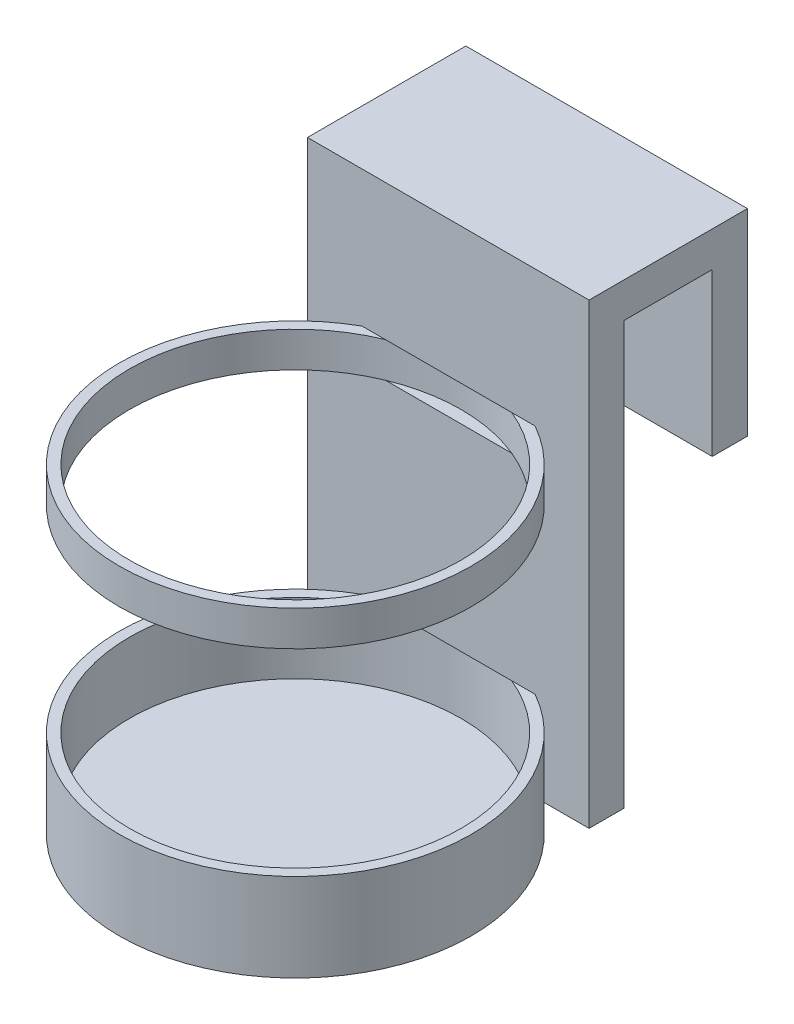
from build123d import *

# Parameters (mm, degrees)
BOSS_EXTRUDE1_DEPTH = 80
SKETCH2_R           = 50
BOSS_EXTRUDE2_DEPTH = 10
SKETCH3_R           = 47.09331112
CUT_EXTRUDE1_DEPTH  = 10
SKETCH4_R           = 50
BOSS_EXTRUDE3_DEPTH = 25
SKETCH5_R           = 47.09331112
CUT_EXTRUDE2_DEPTH  = 20


with BuildPart() as part:
    # Sketch1 → Boss-Extrude1 (new body)
    with BuildSketch(Plane(origin=(0, 0, 0), x_dir=(0, 0, -1), z_dir=(1, 0, 0))):
        Polygon((40.609756098, 22.658536585), (40.609756098, 78.658536585), (-4.390243902, 78.658536585), (-4.390243902, -51.341463415), (5.609756098, -51.341463415), (5.609756098, 68.658536585), (30.609756098, 68.658536585), (30.609756098, 22.658536585), align=None)
    extrude(amount=BOSS_EXTRUDE1_DEPTH)

    # Sketch2 → Boss-Extrude2 (add)
    with BuildSketch(Plane(origin=(0, 30, 0), x_dir=(1, 0, 0), z_dir=(0, 1, 0))):
        with Locations((40.088163703, -47.932474998)):
            Circle(SKETCH2_R)
    extrude(amount=BOSS_EXTRUDE2_DEPTH)

    # Sketch3 → Cut-Extrude1 (cut)
    with BuildSketch(Plane(origin=(0, 40, 0), x_dir=(1, 0, 0), z_dir=(0, 1, 0))):
        with Locations(Location((40.088163703, -47.932474998, 0), (0, 0, 67.607335059))):
            Circle(SKETCH3_R)
    extrude(amount=-CUT_EXTRUDE1_DEPTH, mode=Mode.SUBTRACT)

    # Sketch4 → Boss-Extrude3 (add)
    with BuildSketch(Plane(origin=(0, -51, 0), x_dir=(1, 0, 0), z_dir=(0, 1, 0))):
        with Locations((40.088163703, -47.932474998)):
            Circle(SKETCH4_R)
    extrude(amount=BOSS_EXTRUDE3_DEPTH)

    # Sketch5 → Cut-Extrude2 (cut)
    with BuildSketch(Plane(origin=(0, -26, 0), x_dir=(1, 0, 0), z_dir=(0, 1, 0))):
        with Locations(Location((40.088163703, -47.932474998, 0), (0, 0, 67.607335059))):
            Circle(SKETCH5_R)
    extrude(amount=-CUT_EXTRUDE2_DEPTH, mode=Mode.SUBTRACT)


solid = part.part
